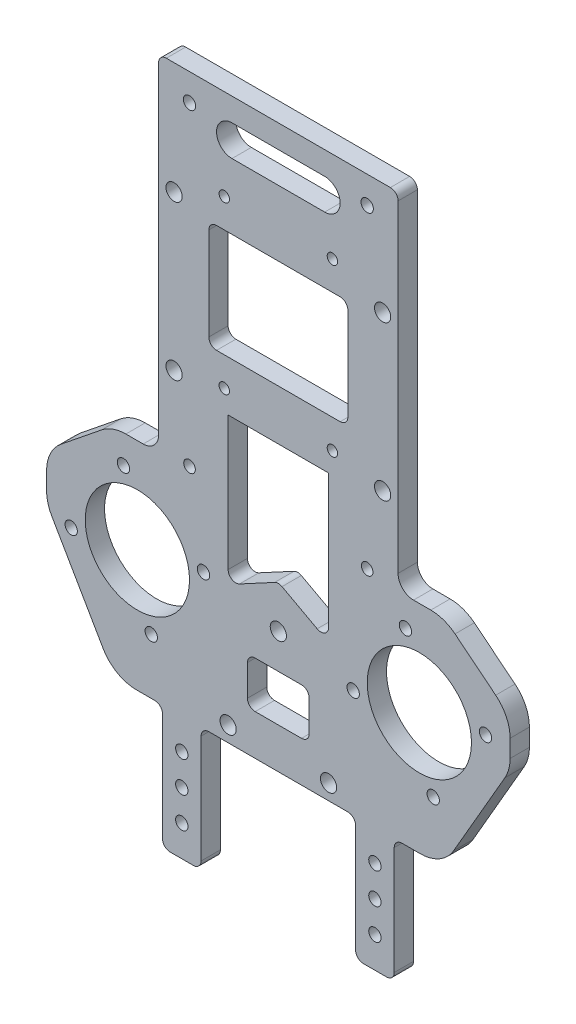
from build123d import *

# Parameters (mm, degrees)
SKETCH_1_R          = 13.5
SKETCH_1_R_2        = 1.6
SKETCH_1_R_3        = 2.1
SKETCH_1_R_4        = 1.35
SKETCH_1_R_5        = 1.5
EXTRUDE_1_DEPTH     = 5
FILLET_1_R          = 10
FILLET_2_R          = 4
FILLET_3_R          = 2
CUT_EXTRUDE_1_DEPTH = 109.282039139
SKETCH_3_W          = 26
SKETCH_3_H          = 20
CUT_EXTRUDE_2_DEPTH = 109.282039139


with BuildPart() as part:
    # 草图1 → 凸台-拉伸1 (new body)
    with BuildSketch(Plane.XY):
        with BuildLine():
            Line((-42.5, -55.5), (-30, -55.5))
            Line((-30, -55.5), (-30, -87.5))
            Line((-30, -87.5), (-20, -87.5))
            Line((-20, -87.5), (-20, -55.5))
            Line((-20, -55.5), (20, -55.5))
            Line((20, -55.5), (20, -87.5))
            Line((20, -87.5), (30, -87.5))
            Line((30, -87.5), (30, -55.5))
            Line((30, -55.5), (42.5, -55.5))
            Line((42.5, -55.5), (60, -25.189110868))
            Line((60, -25.189110868), (60, -13.189110868))
            Line((60, -13.189110868), (43, 0.5))
            Line((43, 0.5), (31, 0.5))
            Line((31, 0.5), (31, 88))
            ThreePointArc((31, 88), (30.414213562, 89.414213562), (29, 90))
            Line((29, 90), (-29, 90))
            ThreePointArc((-29, 90), (-30.414213562, 89.414213562), (-31, 88))
            Line((-31, 88), (-31, 0.5))
            Line((-31, 0.5), (-43, 0.5))
            Line((-43, 0.5), (-60, -13.189110868))
            Line((-60, -13.189110868), (-60, -25.189110868))
            Line((-60, -25.189110868), (-42.5, -55.5))
        make_face()
        with Locations((36.5, -24)):
            Circle(SKETCH_1_R, mode=Mode.SUBTRACT)
        with Locations((32.902497054, -6.87376362)):
            Circle(SKETCH_1_R_2, mode=Mode.SUBTRACT)
        with Locations((53.62623638, -20.402497054)):
            Circle(SKETCH_1_R_2, mode=Mode.SUBTRACT)
        with Locations((19.37376362, -27.597502946)):
            Circle(SKETCH_1_R_2, mode=Mode.SUBTRACT)
        with Locations((40.097502946, -41.12623638)):
            Circle(SKETCH_1_R_2, mode=Mode.SUBTRACT)
        with Locations((-36.5, -24)):
            Circle(SKETCH_1_R, mode=Mode.SUBTRACT)
        with Locations((-40.097502946, -6.87376362)):
            Circle(SKETCH_1_R_2, mode=Mode.SUBTRACT)
        with Locations((-19.37376362, -20.402497054)):
            Circle(SKETCH_1_R_2, mode=Mode.SUBTRACT)
        with Locations((-32.902497054, -41.12623638)):
            Circle(SKETCH_1_R_2, mode=Mode.SUBTRACT)
        with Locations((-53.62623638, -27.597502946)):
            Circle(SKETCH_1_R_2, mode=Mode.SUBTRACT)
        with Locations((-13, -51.5)):
            Circle(SKETCH_1_R_3, mode=Mode.SUBTRACT)
        with Locations((13, -51.5)):
            Circle(SKETCH_1_R_3, mode=Mode.SUBTRACT)
        with Locations((0, -24)):
            Circle(SKETCH_1_R_3, mode=Mode.SUBTRACT)
        with Locations((27, 21)):
            Circle(SKETCH_1_R_3, mode=Mode.SUBTRACT)
        with Locations((27, 61)):
            Circle(SKETCH_1_R_3, mode=Mode.SUBTRACT)
        with Locations(Location((-27, 21, 0), (0, 0, 180))):
            Circle(SKETCH_1_R_3, mode=Mode.SUBTRACT)
        with Locations(Location((-27, 61, 0), (0, 0, 180))):
            Circle(SKETCH_1_R_3, mode=Mode.SUBTRACT)
        with Locations((-25, -79.5)):
            Circle(SKETCH_1_R_2, mode=Mode.SUBTRACT)
        with Locations((-25, -63.5)):
            Circle(SKETCH_1_R_2, mode=Mode.SUBTRACT)
        with Locations((-25, -71.5)):
            Circle(SKETCH_1_R_2, mode=Mode.SUBTRACT)
        with Locations(Location((25, -79.5, 0), (0, 0, 180))):
            Circle(SKETCH_1_R_2, mode=Mode.SUBTRACT)
        with Locations(Location((25, -71.5, 0), (0, 0, 180))):
            Circle(SKETCH_1_R_2, mode=Mode.SUBTRACT)
        with Locations(Location((25, -63.5, 0), (0, 0, 180))):
            Circle(SKETCH_1_R_2, mode=Mode.SUBTRACT)
        with Locations((14, 23.5)):
            Circle(SKETCH_1_R_4, mode=Mode.SUBTRACT)
        with Locations((-14, 23.5)):
            Circle(SKETCH_1_R_4, mode=Mode.SUBTRACT)
        with Locations((14, 66.5)):
            Circle(SKETCH_1_R_4, mode=Mode.SUBTRACT)
        with Locations((-14, 66.5)):
            Circle(SKETCH_1_R_4, mode=Mode.SUBTRACT)
        with Locations((-23, 83)):
            Circle(SKETCH_1_R_2, mode=Mode.SUBTRACT)
        with Locations((23, 83)):
            Circle(SKETCH_1_R_2, mode=Mode.SUBTRACT)
        with Locations((23, 1.5)):
            Circle(SKETCH_1_R_5, mode=Mode.SUBTRACT)
        with Locations((-23, 1.5)):
            Circle(SKETCH_1_R_5, mode=Mode.SUBTRACT)
    extrude(amount=EXTRUDE_1_DEPTH)

    # 圆角1
    fillet_1_edges = [part.edges().sort_by_distance(p)[0] for p in [
        (-42.5, -55.5, 2.5),
        (-60, -25.189110868, 2.5),
        (-60, -13.189110868, 2.5),
        (-43, 0.5, 2.5),
        (43, 0.5, 2.5),
        (60, -13.189110868, 2.5),
        (60, -25.189110868, 2.5),
        (42.5, -55.5, 2.5),
    ]]
    fillet(fillet_1_edges, radius=FILLET_1_R)

    # 圆角2
    fillet_2_edges = [part.edges().sort_by_distance(p)[0] for p in [
        (-31, 0.5, 2.5),
        (31, 0.5, 2.5),
    ]]
    fillet(fillet_2_edges, radius=FILLET_2_R)

    # 圆角3
    fillet_3_edges = [part.edges().sort_by_distance(p)[0] for p in [
        (30, -55.5, 2.5),
        (30, -87.5, 2.5),
        (20, -87.5, 2.5),
        (20, -55.5, 2.5),
        (-20, -55.5, 2.5),
        (-20, -87.5, 2.5),
        (-30, -87.5, 2.5),
        (-30, -55.5, 2.5),
    ]]
    fillet(fillet_3_edges, radius=FILLET_3_R)

    # 草图2 → 切除-拉伸1 (cut, through all)
    with BuildSketch(Plane.XY.offset(5)):
        with BuildLine():
            Line((10.051800354, -18.412507883), (0.948199646, -13.51056904))
            ThreePointArc((0.948199646, -13.51056904), (0, -13.27151124), (-0.948199646, -13.51056904))
            Line((-0.948199646, -13.51056904), (-10.051800354, -18.412507883))
            ThreePointArc((-10.051800354, -18.412507883), (-12.025573183, -18.368597903), (-13, -16.651565683))
            Line((-13, -16.651565683), (-13, -2))
            ThreePointArc((-13, -2), (-12.414213562, -0.585786438), (-11, 0))
            Line((-11, 0), (11, 0))
            ThreePointArc((11, 0), (12.414213562, -0.585786438), (13, -2))
            Line((13, -2), (13, -16.651565683))
            ThreePointArc((13, -16.651565683), (12.025573183, -18.368597903), (10.051800354, -18.412507883))
        make_face()
        with BuildLine():
            Line((-8, -35), (-8, -43))
            ThreePointArc((-8, -43), (-7.414213562, -44.414213562), (-6, -45))
            Line((-6, -45), (6, -45))
            ThreePointArc((6, -45), (7.414213562, -44.414213562), (8, -43))
            Line((8, -43), (8, -35))
            ThreePointArc((8, -35), (7.414213562, -33.585786438), (6, -33))
            Line((6, -33), (-6, -33))
            ThreePointArc((-6, -33), (-7.414213562, -33.585786438), (-8, -35))
        make_face()
        with BuildLine():
            Line((-16, 59), (16, 59))
            ThreePointArc((16, 59), (17.414213562, 58.414213562), (18, 57))
            Line((18, 57), (18, 33))
            ThreePointArc((18, 33), (17.414213562, 31.585786438), (16, 31))
            Line((16, 31), (-16, 31))
            ThreePointArc((-16, 31), (-17.414213562, 31.585786438), (-18, 33))
            Line((-18, 33), (-18, 57))
            ThreePointArc((-18, 57), (-17.414213562, 58.414213562), (-16, 59))
        make_face()
        with BuildLine():
            Line((-12, 84), (12, 84))
            ThreePointArc((12, 84), (16, 80), (12, 76))
            Line((12, 76), (-12, 76))
            ThreePointArc((-12, 76), (-16, 80), (-12, 84))
        make_face()
    extrude(amount=-CUT_EXTRUDE_1_DEPTH, mode=Mode.SUBTRACT)

    # 草图3 → 切除-拉伸2 (cut, through all)
    with BuildSketch(Plane.XY.offset(5)):
        with Locations((0, 8)):
            Rectangle(SKETCH_3_W, SKETCH_3_H)
    extrude(amount=-CUT_EXTRUDE_2_DEPTH, mode=Mode.SUBTRACT)


solid = part.part
